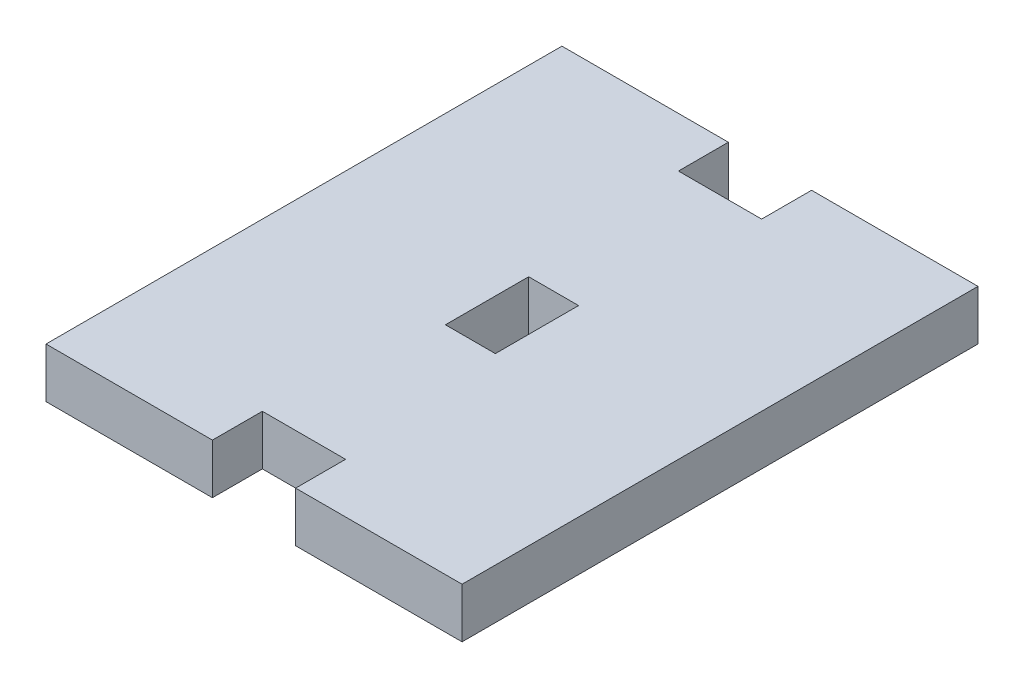
from build123d import *

# Parameters (mm, degrees)
ESBO_O1_W                = 50
ESBO_O1_H                = 62
RESSALTO_EXTRUS_O2_DEPTH = 6
ESBO_O3_W                = 10
ESBO_O3_H                = 6
CORTE_EXTRUS_O1_DEPTH    = 6
ESBO_O4_W                = 10
ESBO_O4_H                = 6
CORTE_EXTRUS_O2_DEPTH    = 6
ESBO_O5_W                = 6
ESBO_O5_H                = 10
CORTE_EXTRUS_O3_DEPTH    = 6


with BuildPart() as part:
    # Esboço1 → Ressalto-extrusão2 (new body)
    with BuildSketch(Plane(origin=(0, 0, 0), x_dir=(1, 0, 0), z_dir=(0, 1, 0))):
        Rectangle(ESBO_O1_W, ESBO_O1_H)
    extrude(amount=RESSALTO_EXTRUS_O2_DEPTH)

    # Esboço3 → Corte-extrusão1 (cut)
    with BuildSketch(Plane.XY.offset(31)):
        with Locations((0, 3)):
            Rectangle(ESBO_O3_W, ESBO_O3_H)
    extrude(amount=-CORTE_EXTRUS_O1_DEPTH, mode=Mode.SUBTRACT)

    # Esboço4 → Corte-extrusão2 (cut)
    with BuildSketch(Plane(origin=(0, 0, -31), x_dir=(-1, 0, 0), z_dir=(0, 0, -1))):
        with Locations((0, 3)):
            Rectangle(ESBO_O4_W, ESBO_O4_H)
    extrude(amount=-CORTE_EXTRUS_O2_DEPTH, mode=Mode.SUBTRACT)

    # Esboço5 → Corte-extrusão3 (cut)
    with BuildSketch(Plane(origin=(0, 6, 0), x_dir=(1, 0, 0), z_dir=(0, 1, 0))):
        Rectangle(ESBO_O5_W, ESBO_O5_H)
    extrude(amount=-CORTE_EXTRUS_O3_DEPTH, mode=Mode.SUBTRACT)


solid = part.part
